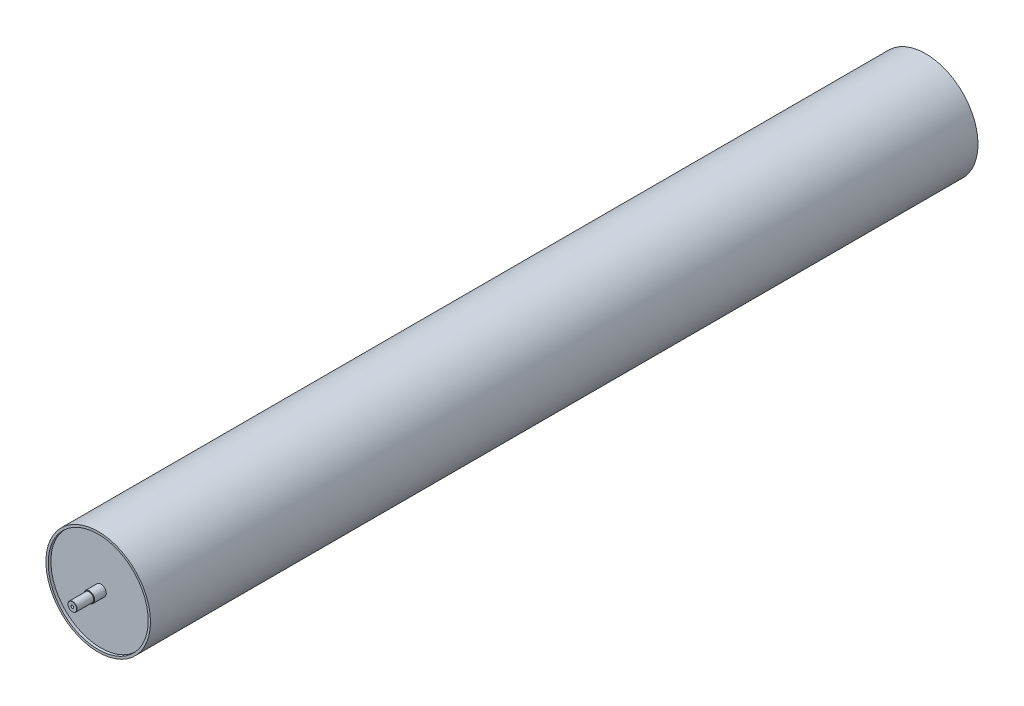
from build123d import *

# Parameters (mm, degrees)
SKETCH1_R           = 97
SKETCH1_R_2         = 92.76
BOSS_EXTRUDE1_DEPTH = 767.5
BOSS_EXTRUDE2_START = -10
SKETCH2_R           = 92.76
BOSS_EXTRUDE2_DEPTH = 5
CHAMFER1_SIZE       = 0.5


with BuildPart() as part:
    # Sketch1 → Boss-Extrude1 (new, symmetric)
    with BuildSketch(Plane.XY):
        Circle(SKETCH1_R)
        Circle(SKETCH1_R_2, mode=Mode.SUBTRACT)
    extrude(amount=BOSS_EXTRUDE1_DEPTH, both=True)

    # Sketch2 → Boss-Extrude2 (add)
    with BuildSketch(Plane.XY.offset(767.5).offset(BOSS_EXTRUDE2_START)):
        Circle(SKETCH2_R)
    boss_extrude2 = extrude(amount=BOSS_EXTRUDE2_DEPTH)

    # Sketch5 → Revolve1 (revolve)
    with BuildSketch(Plane(origin=(0, 0, 0), x_dir=(0, 0, -1), z_dir=(1, 0, 0)), mode=Mode.PRIVATE) as revolve1_sk:
        Polygon((-784.5, 10), (784.5, 10), (784.5, 8.5), (815.5, 8.5), (815.5, 0), (-815.5, 0), (-815.5, 8.5), (-784.5, 8.5), align=None)
    revolve(revolve1_sk.sketch.rotate(Axis((0, 0, -815.5), (0, 0, -1)), 180), axis=Axis((0, 0, -815.5), (0, 0, -1)))

    # Chamfer1
    chamfer1_edges = [part.edges().sort_by_distance(p)[0] for p in [
        (0, 10, -784.5),
        (0, 10, 784.5),
        (0, 8.5, -815.5),
        (0, 8.5, 815.5),
    ]]
    chamfer(chamfer1_edges, length=CHAMFER1_SIZE)

    # Sketch7 → M6 Tapped Hole1 (revolve, cut)
    with BuildSketch(Plane(origin=(0, 0, 815.5), x_dir=(0, -1, 0), z_dir=(1, 0, 0))):
        Polygon((0, 0), (0, 16.502151548), (2.5, 15), (2.5, 0), align=None)
    m6_tapped_hole1 = revolve(axis=Axis((0, 0, 821.85), (0, 0, -1)), mode=Mode.SUBTRACT)

    # Mirror3: Boss-Extrude2, M6 Tapped Hole1 across plane
    add(boss_extrude2.mirror(Plane.XY))
    add(m6_tapped_hole1.mirror(Plane.XY), mode=Mode.SUBTRACT)


solid = part.part
